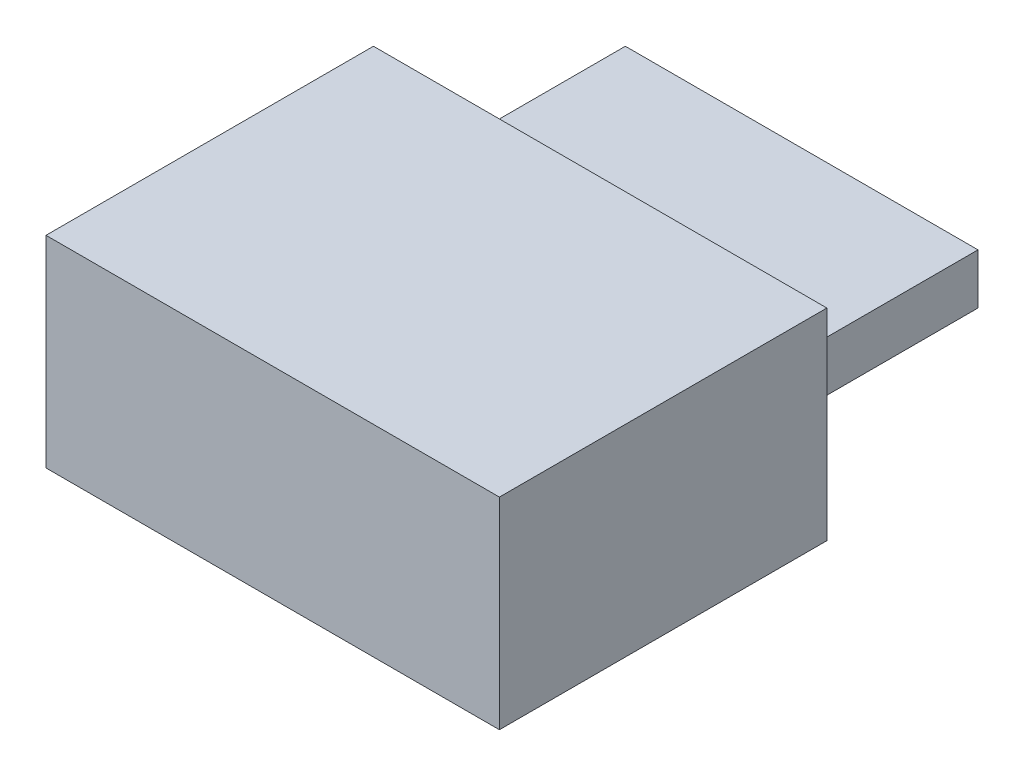
from build123d import *

# Parameters (mm, degrees)
SKETCH1_W           = 9
SKETCH1_H           = 4
BOSS_EXTRUDE1_DEPTH = 3.25
SKETCH2_W           = 7
SKETCH2_H           = 1
BOSS_EXTRUDE2_DEPTH = 4


with BuildPart() as part:
    # Sketch1 → Boss-Extrude1 (new, symmetric)
    with BuildSketch(Plane.XY):
        Rectangle(SKETCH1_W, SKETCH1_H)
    extrude(amount=BOSS_EXTRUDE1_DEPTH, both=True)

    # Sketch2 → Boss-Extrude2 (add)
    with BuildSketch(Plane(origin=(0, 0, -3.25), x_dir=(-1, 0, 0), z_dir=(0, 0, -1))):
        Rectangle(SKETCH2_W, SKETCH2_H)
    extrude(amount=BOSS_EXTRUDE2_DEPTH)


solid = part.part
